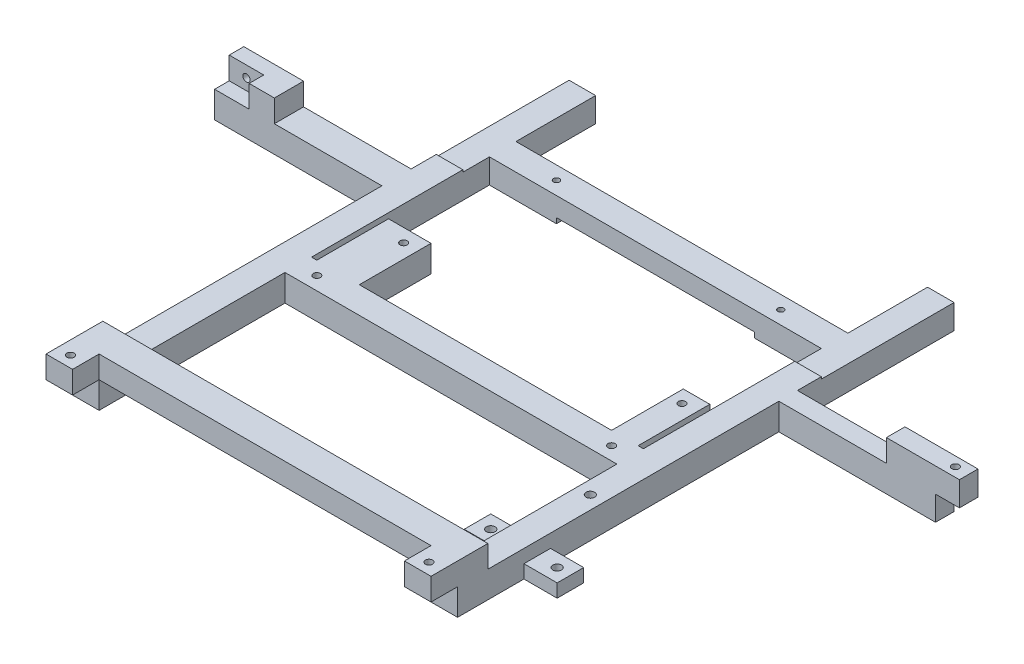
from build123d import *

# Parameters (mm, degrees)
FRAME_DEPTH                = 10
SKETCH10_W                 = 145
SKETCH10_H                 = 50
CUT_EXTRUDE1_DEPTH         = 0.8
F_6_32_TAPPED_HOLE2_D      = 2.7051
F_4_40_TAPPED_HOLE1_D      = 2.2606
BOTTOM_LEGS_DEPTH          = 8.4
SIDE_ARMS_S_W              = 63
SIDE_ARMS_S_H              = 11
SIDE_ARMS_S_W_2            = 59
SIDE_ARMS_S_H_2            = 7
SIDE_ARMS_DEPTH            = 10
SIDE_TABS_S_W              = 13
SIDE_TABS_S_H              = 5.5
SIDE_TABS_S_W_2            = 9
SIDE_TABS_S_H_2            = 7
SIDE_TABS_DEPTH            = 8.4
BOTTOM_SCREWS_D            = 2.7051
LEFT_SCREW_D               = 2.7051
RIGHT_FOOT_S_W             = 7
RIGHT_FOOT_S_H             = 9.2
RIGHT_FOOT_DEPTH           = 9
RIGHT_SCREW_D              = 2.7051
CONTROL_BOARD_RELIEF_S_W   = 74.5
CONTROL_BOARD_RELIEF_S_H   = 10
CONTROL_BOARD_RELIEF_DEPTH = 2
MONITOR_SIDE_GUIDES_S_W    = 9.5
MONITOR_SIDE_GUIDES_S_H    = 11
MONITOR_SIDE_GUIDES_S_H_2  = 7
SIDE_MONITOR_GUIDES_DEPTH  = 8.4
LED_BOARD_S_W              = 35
LED_BOARD_S_H              = 10
LED_BOARD_DEPTH            = 5
F_4_CLEARANCE_HOLE1_D      = 3.2639
F_4_CLEARANCE_HOLE1_DEPTH  = 10


with BuildPart() as part:
    # Sketch1 → frame (new body)
    with BuildSketch(Plane(origin=(0, 0, 0), x_dir=(1, 0, 0), z_dir=(0, 1, 0))):
        Polygon((-72.5, 93.5), (-72.5, -93.5), (-62.5, -93.5), (-62.5, -23.5), (62.5, -23.5), (62.5, -93.5), (72.5, -93.5), (72.5, 93.5), (62.5, 93.5), (62.5, 63.5), (-62.5, 63.5), (-62.5, 93.5), align=None)
        Polygon((-62.5, -13.5), (-60.5, -13.5), (-60.5, 13.5), (-44.5, 13.5), (-44.5, -13.5), (50.5, -13.5), (50.5, 13.5), (60.5, 13.5), (60.5, -13.5), (62.5, -13.5), (62.5, 53.5), (-62.5, 53.5), align=None, mode=Mode.SUBTRACT)
    extrude(amount=FRAME_DEPTH)

    # Sketch10 → Cut-Extrude1 (cut)
    with BuildSketch(Plane(origin=(0, 10, 0), x_dir=(1, 0, 0), z_dir=(0, 1, 0))):
        with Locations((0, 68.5)):
            Rectangle(SKETCH10_W, SKETCH10_H)
    extrude(amount=-CUT_EXTRUDE1_DEPTH, mode=Mode.SUBTRACT)

    # #6-32 Tapped Hole2 (through all)
    with Locations(Plane(origin=(0, 0, 0), x_dir=(-1, 0, 0), z_dir=(0, -1, 0))):
        with Locations((55.5, -18.5), (49.8, 8.5), (-55, 8.5), (-55.5, -18.5)):
            Hole(F_6_32_TAPPED_HOLE2_D / 2)

    # #4-40 Tapped Hole1 (through all)
    with Locations(Plane(origin=(0, 0, 0), x_dir=(-1, 0, 0), z_dir=(0, -1, 0))):
        with Locations((42.25, 58.5), (-42.25, 58.5)):
            Hole(F_4_40_TAPPED_HOLE1_D / 2)

    # bottom-legs-s → bottom-legs (add)
    with BuildSketch(Plane(origin=(0, 10, 0), x_dir=(1, 0, 0), z_dir=(0, 1, 0))):
        Polygon((-72.5, -103.5), (-72.5, -82.1), (72.5, -82.1), (72.5, -103.5), (62.5, -103.5), (62.5, -93.5), (-62.5, -93.5), (-62.5, -103.5), align=None)
    extrude(amount=BOTTOM_LEGS_DEPTH)

    # side-arms-s → side-arms (add)
    with BuildSketch(Plane(origin=(0, 10, 0), x_dir=(1, 0, 0), z_dir=(0, 1, 0))):
        with Locations((-104, 28.5)):
            Rectangle(SIDE_ARMS_S_W, SIDE_ARMS_S_H)
        with Locations((102, 31)):
            Rectangle(SIDE_ARMS_S_W_2, SIDE_ARMS_S_H_2)
    extrude(amount=-SIDE_ARMS_DEPTH)

    # side-tabs-s → side-tabs (add)
    with BuildSketch(Plane(origin=(0, 10, 0), x_dir=(1, 0, 0), z_dir=(0, 1, 0))):
        with Locations((-129, 31.25)):
            Rectangle(SIDE_TABS_S_W, SIDE_TABS_S_H)
        with Locations((127, 31)):
            Rectangle(SIDE_TABS_S_W_2, SIDE_TABS_S_H_2)
    extrude(amount=SIDE_TABS_DEPTH)

    # bottom-screws (through all)
    with Locations(Plane(origin=(0, 18.4, 0), x_dir=(1, 0, 0), z_dir=(0, 1, 0))):
        with Locations((-67.5, -99.27), (67.5, -99.27)):
            Hole(BOTTOM_SCREWS_D / 2)

    # left-screw (through all)
    with Locations(Plane.XY.offset(-28.5)):
        with Locations((-129, 14.2)):
            Hole(LEFT_SCREW_D / 2)

    # right-foot-s → right-foot (add)
    with BuildSketch(Plane(origin=(131.5, 0, 0), x_dir=(0, 0, -1), z_dir=(1, 0, 0))):
        with Locations((31, 13.8)):
            Rectangle(RIGHT_FOOT_S_W, RIGHT_FOOT_S_H)
    extrude(amount=RIGHT_FOOT_DEPTH)

    # right-screw (through all)
    with Locations(Plane(origin=(0, 9.2, 0), x_dir=(-1, 0, 0), z_dir=(0, -1, 0))):
        with Locations((-135.5, 31)):
            Hole(RIGHT_SCREW_D / 2)

    # control-board-relief-s → control-board-relief (cut)
    with BuildSketch(Plane.XZ):
        with Locations((0, -58.5)):
            Rectangle(CONTROL_BOARD_RELIEF_S_W, CONTROL_BOARD_RELIEF_S_H)
    extrude(amount=-CONTROL_BOARD_RELIEF_DEPTH, mode=Mode.SUBTRACT)

    # monitor-side-guides-s → side-monitor-guides (add)
    with BuildSketch(Plane(origin=(0, 10, 0), x_dir=(1, 0, 0), z_dir=(0, 1, 0))):
        with Locations((-117.75, 28.5)):
            Rectangle(MONITOR_SIDE_GUIDES_S_W, MONITOR_SIDE_GUIDES_S_H)
        with Locations((117.75, 31)):
            Rectangle(MONITOR_SIDE_GUIDES_S_W, MONITOR_SIDE_GUIDES_S_H_2)
    extrude(amount=SIDE_MONITOR_GUIDES_DEPTH)

    # led-board-s → led-board (add)
    with BuildSketch(Plane.XZ):
        with Locations((67.5, 63.5)):
            Rectangle(LED_BOARD_S_W, LED_BOARD_S_H)
    extrude(amount=-LED_BOARD_DEPTH)

    # #4 Clearance Hole1
    with Locations(Plane(origin=(67.5, 0, 38.5), x_dir=(0, 0, -1), z_dir=(0, -1, 0))):
        with Locations((0, 0), (-25, 12.5), (-25, -12.5)):
            Hole(F_4_CLEARANCE_HOLE1_D / 2, depth=F_4_CLEARANCE_HOLE1_DEPTH)


solid = part.part
